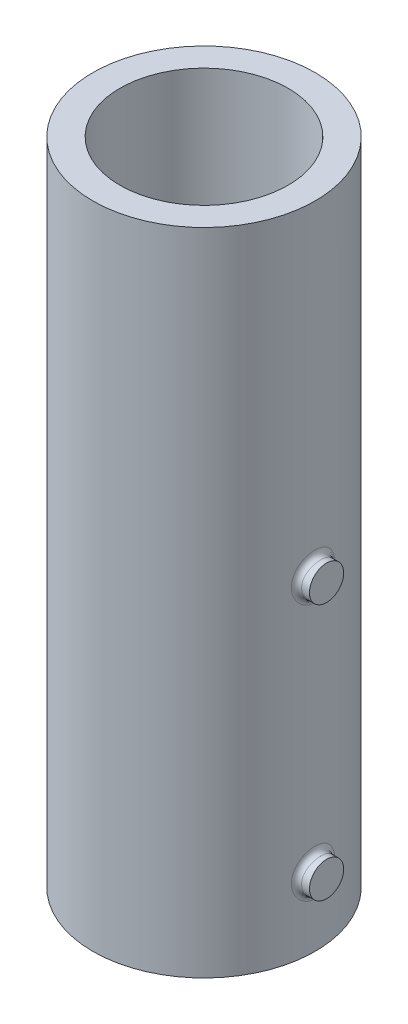
from build123d import *
from build123d.topology import SkipClean

# Parameters (mm, degrees)
SKETCH1_R                            = 19.5
SKETCH1_R_2                          = 14.75
BOSS_EXTRUDE1_DEPTH                  = 57
SKETCH2_R                            = 3
BOSS_EXTRUDE2_DEPTH                  = 2
BOSS_EXTRUDE2_DIRECTION_2_REACH      = 73.765
BOSS_EXTRUDE2_DIRECTION_2_END_RADIUS = 19.5
SKETCH3_R                            = 3
BOSS_EXTRUDE4_DEPTH                  = 2
BOSS_EXTRUDE4_DIRECTION_2_REACH      = 74.871
BOSS_EXTRUDE4_DIRECTION_2_END_RADIUS = 19.5
FILLET3_R                            = 1


with BuildPart() as part:
    # Sketch1 → Boss-Extrude1 (new, symmetric)
    with BuildSketch(Plane(origin=(0, 0, 0), x_dir=(1, 0, 0), z_dir=(0, 1, 0))):
        Circle(SKETCH1_R)
        Circle(SKETCH1_R_2, mode=Mode.SUBTRACT)
    extrude(amount=BOSS_EXTRUDE1_DEPTH, both=True)


with BuildPart() as body_2:
    # Sketch2 → Boss-Extrude2 (new body)
    with BuildSketch(Plane(origin=(19.5, 0, 0), x_dir=(0, 0, -1), z_dir=(1, 0, 0))):
        with Locations((0, -45)):
            Circle(SKETCH2_R)
        Circle(SKETCH2_R)
    extrude(amount=BOSS_EXTRUDE2_DEPTH)

    # Boss-Extrude2 direction 2: up to this cylinder (the profile starts outside it)
    with SkipClean():  # the faces are left unmerged after this step: merging them gives an invalid solid
        boss_extrude2_direction_2_end = Plane(origin=(0, -22.5, 0), z_dir=(0, -1, 0)) * Cylinder(BOSS_EXTRUDE2_DIRECTION_2_END_RADIUS, 232.53, mode=Mode.PRIVATE)
        # Sketch2 → Boss-Extrude2 direction 2 (add, up to the surface)
        with BuildSketch(Plane(origin=(19.5, 0, 0), x_dir=(0, 0, -1), z_dir=(1, 0, 0)), mode=Mode.PRIVATE) as boss_extrude2_direction_2_sk1:
            with Locations((0, -45)):
                Circle(SKETCH2_R)
        boss_extrude2_direction_2_tool1 = extrude(boss_extrude2_direction_2_sk1.sketch, amount=-BOSS_EXTRUDE2_DIRECTION_2_REACH, mode=Mode.PRIVATE) - boss_extrude2_direction_2_end
        add(boss_extrude2_direction_2_tool1.solids().sort_by_distance((19.5, -45, 0))[0])
        add(boss_extrude2_direction_2_tool1.solids().sort_by_distance((19.5, -45, 0))[1])
        # Sketch2 → Boss-Extrude2 direction 2 (add, up to the surface)
        with BuildSketch(Plane(origin=(19.5, 0, 0), x_dir=(0, 0, -1), z_dir=(1, 0, 0)), mode=Mode.PRIVATE) as boss_extrude2_direction_2_sk2:
            Circle(SKETCH2_R)
        boss_extrude2_direction_2_tool2 = extrude(boss_extrude2_direction_2_sk2.sketch, amount=-BOSS_EXTRUDE2_DIRECTION_2_REACH, mode=Mode.PRIVATE) - boss_extrude2_direction_2_end
        add(boss_extrude2_direction_2_tool2.solids().sort_by_distance((19.5, 0, 0))[0])
        add(boss_extrude2_direction_2_tool2.solids().sort_by_distance((19.5, 0, 0))[1])


with BuildPart() as body_3:
    # Sketch3 → Boss-Extrude4 (new body)
    with BuildSketch(Plane.ZY.offset(19.5)):
        Circle(SKETCH3_R)
    extrude(amount=BOSS_EXTRUDE4_DEPTH)

    # Boss-Extrude4 direction 2: up to this cylinder (the profile starts outside it)
    with SkipClean():  # the faces are left unmerged after this step: merging them gives an invalid solid
        boss_extrude4_direction_2_end = Plane(origin=(0, 0, 0), z_dir=(0, -1, 0)) * Cylinder(BOSS_EXTRUDE4_DIRECTION_2_END_RADIUS, 189.742, mode=Mode.PRIVATE)
        # Sketch3 → Boss-Extrude4 direction 2 (add, up to the surface)
        with BuildSketch(Plane.ZY.offset(19.5), mode=Mode.PRIVATE) as boss_extrude4_direction_2_sk1:
            Circle(SKETCH3_R)
        boss_extrude4_direction_2_tool1 = extrude(boss_extrude4_direction_2_sk1.sketch, amount=-BOSS_EXTRUDE4_DIRECTION_2_REACH, mode=Mode.PRIVATE) - boss_extrude4_direction_2_end
        add(boss_extrude4_direction_2_tool1.solids().sort_by_distance((-19.5, 0, 0))[0])
        add(boss_extrude4_direction_2_tool1.solids().sort_by_distance((-19.5, 0, 0))[1])


with BuildPart() as body_2_1:
    add(body_2.part)

    # Combine1: union part, body 3
    add(part.part)
    add(body_3.part)

    # Fillet3
    fillet3_edges = [body_2_1.edges().sort_by_distance(p)[0] for p in [
        (-19.267848866, 0, -3.000000015),
        (19.384270612, -47.121307729, -2.121332964),
        (19.384270592, 2.121307735, -2.121332972),
    ]]
    fillet(fillet3_edges, radius=FILLET3_R)


solid = body_2_1.part
